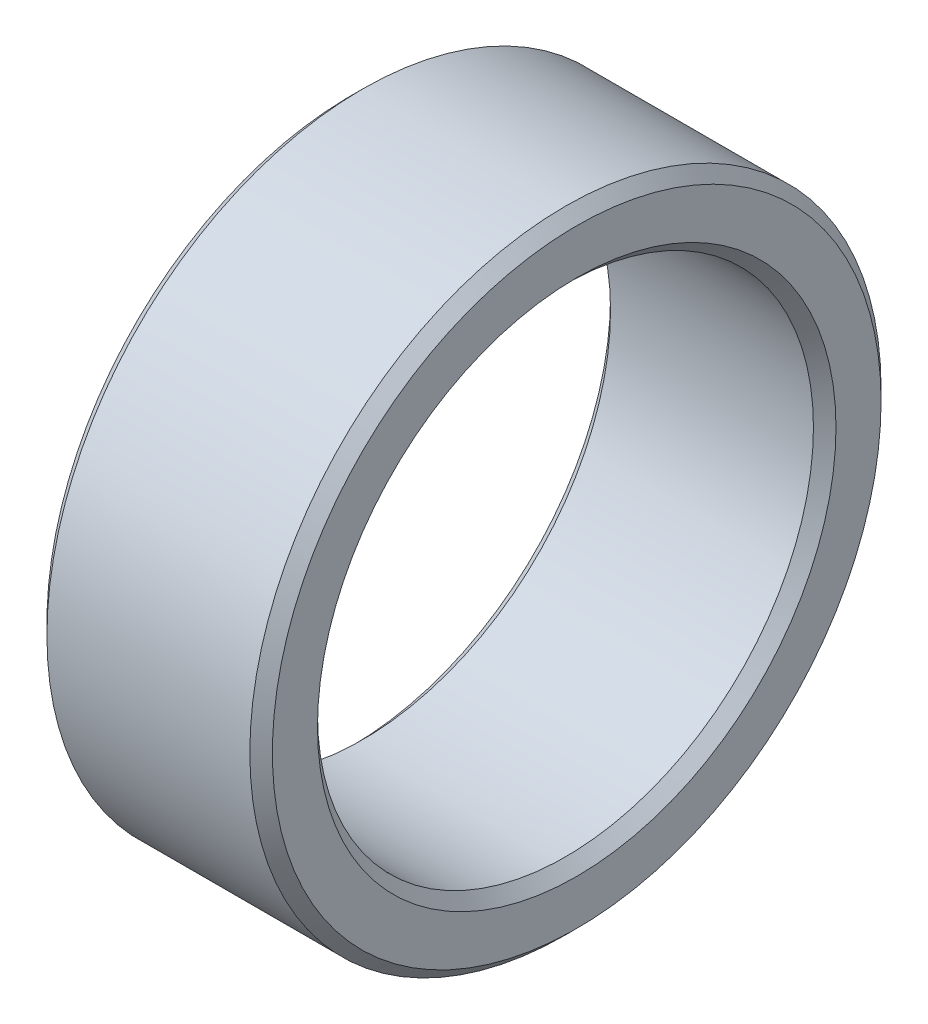
from build123d import *


with BuildPart() as part:
    # Эскиз1 → Повернуть1 (revolve)
    with BuildSketch(Plane.XY, mode=Mode.PRIVATE) as revolve_1_sk:
        Polygon((0, 11.5), (0.5, 11), (9.5, 11), (10, 11.5), (10, 13.5), (9.5, 14), (0.5, 14), (0, 13.5), align=None)
    revolve(revolve_1_sk.sketch.rotate(Axis((0, 0, 0), (1, 0, 0)), 270), axis=Axis((0, 0, 0), (1, 0, 0)))


solid = part.part
